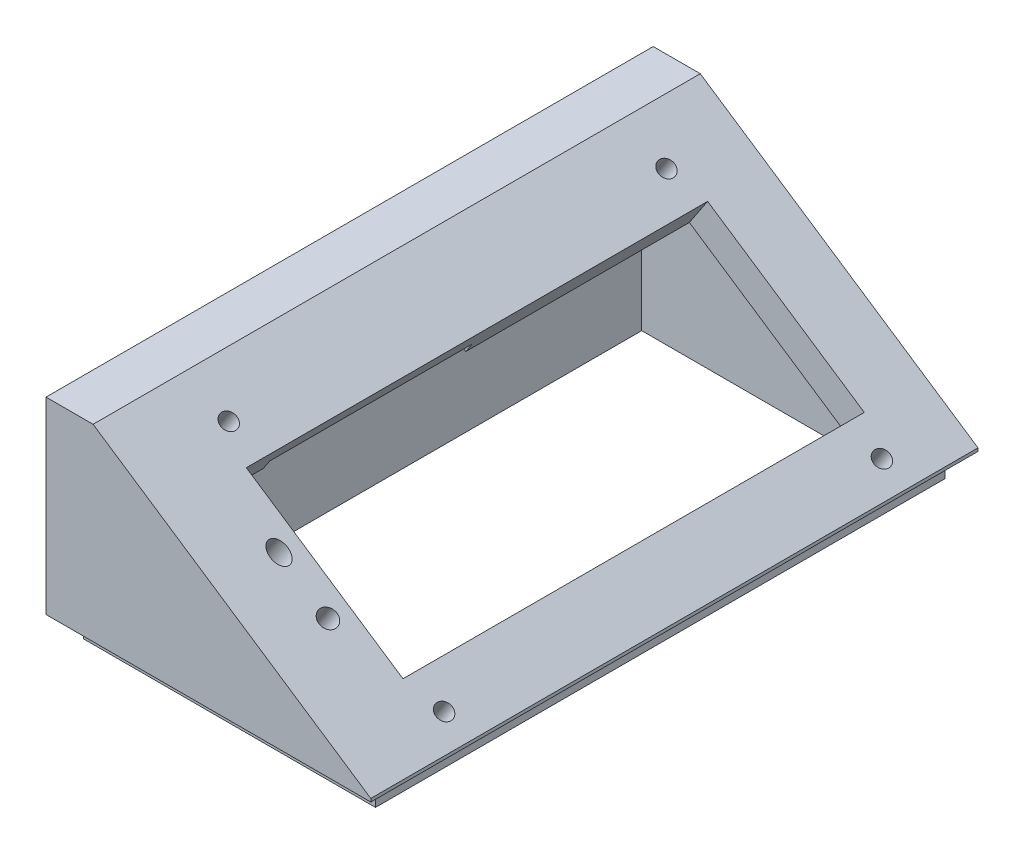
from build123d import *

# Parameters (mm, degrees)
BOSS_EXTRUDE1_DEPTH       = 64.5
SKETCH3_W                 = 62
SKETCH3_H                 = 121
BOSS_EXTRUDE3_DEPTH       = 4.5
SKETCH6_W                 = 40
SKETCH6_H                 = 98
CUT_EXTRUDE3_DEPTH        = 7
SKETCH5_W                 = 57.24
SKETCH5_H                 = 111
CUT_EXTRUDE2_DEPTH        = 1.23
CUT_EXTRUDE1_DEPTH        = 111
CUT_EXTRUDE4_REACH        = 90.677
SKETCH7_R                 = 1.925
SKETCH7_RX                = 2.5
SKETCH7_RY                = 1.85
F_1_0MM_DOWEL_HOLE1_D     = 3.5
F_1_0MM_DOWEL_HOLE1_DEPTH = 7
SKETCH10_W                = 20
SKETCH10_H                = 13
CUT_EXTRUDE5_DEPTH        = 10
SKETCH11_W                = 11
SKETCH11_H                = 43
CUT_EXTRUDE6_DEPTH        = 2.5
SKETCH12_W                = 2
SKETCH12_H                = 8.260777535
CUT_EXTRUDE7_DEPTH        = 153.121661837


with BuildPart() as part:
    # Sketch1 → Boss-Extrude1 (new, symmetric)
    with BuildSketch(Plane.XY):
        Polygon((0, 0), (70, 0), (10, 40), (0, 40), align=None)
    extrude(amount=BOSS_EXTRUDE1_DEPTH, both=True)

    # Sketch3 → Boss-Extrude3 (add)
    with BuildSketch(Plane.XZ):
        with Locations((35, 0)):
            Rectangle(SKETCH3_W, SKETCH3_H)
    extrude(amount=BOSS_EXTRUDE3_DEPTH)

    # Sketch6 → Cut-Extrude3 (cut)
    with BuildSketch(Plane(origin=(21.538461538, 32.307692308, 0), x_dir=(0.8320502943378438, -0.5547001962252291, 0), z_dir=(0.5547001962252291, 0.8320502943378438, 0))):
        with Locations((23.632495094, 2.5)):
            Rectangle(SKETCH6_W, SKETCH6_H)
    extrude(amount=-CUT_EXTRUDE3_DEPTH, mode=Mode.SUBTRACT)

    # Sketch5 → Cut-Extrude2 (cut)
    with BuildSketch(Plane.XZ.offset(4.5)):
        with Locations((35.18, 0)):
            Rectangle(SKETCH5_W, SKETCH5_H)
    extrude(amount=-CUT_EXTRUDE2_DEPTH, mode=Mode.SUBTRACT)

    # Sketch4 → Cut-Extrude1 (cut)
    with BuildSketch(Plane.XY.offset(55.5)):
        Polygon((63.780493494, -4.266615306), (6.558549313, 33.881347482), (6.558549313, -4.5), (63.780493494, -4.5), align=None)
    extrude(amount=-CUT_EXTRUDE1_DEPTH, mode=Mode.SUBTRACT)

    # Sketch7 → Cut-Extrude4 (cut, up to next)
    with BuildSketch(Plane(origin=(21.538461538, 32.307692308, 0), x_dir=(0.8320502943378438, -0.5547001962252291, 0), z_dir=(0.5547001962252291, 0.8320502943378438, 0)), mode=Mode.PRIVATE) as cut_extrude4_sk1:
        with Locations(Location((29.882495094, -51, 0), (0, 0, 180))):
            Circle(SKETCH7_R)
    cut_extrude4_tool1 = extrude(cut_extrude4_sk1.sketch, amount=-CUT_EXTRUDE4_REACH, mode=Mode.PRIVATE) & part.part
    # Sketch7 → Cut-Extrude4 (cut, up to next)
    with BuildSketch(Plane(origin=(21.538461538, 32.307692308, 0), x_dir=(0.8320502943378438, -0.5547001962252291, 0), z_dir=(0.5547001962252291, 0.8320502943378438, 0)), mode=Mode.PRIVATE) as cut_extrude4_sk2:
        with Locations((17.382495094, -51)):
            Ellipse(SKETCH7_RX, SKETCH7_RY)
    cut_extrude4_tool2 = extrude(cut_extrude4_sk2.sketch, amount=-CUT_EXTRUDE4_REACH, mode=Mode.PRIVATE) & part.part
    add(cut_extrude4_tool1.solids().sort_by_distance((46.4022, 15.731866, 51))[0], mode=Mode.SUBTRACT)
    add(cut_extrude4_tool2.solids().sort_by_distance((36.001572, 22.665619, 51))[0], mode=Mode.SUBTRACT)

    # Ø1.0mm Dowel Hole1
    with Locations(Plane(origin=(21.538461538, 32.307692308, 0), x_dir=(0.8320502943378438, -0.5547001962252291, 0), z_dir=(0.5547001962252291, 0.8320502943378438, 0))):
        with Locations((-3.867504906, -44), (-3.867504906, 49), (51.132495094, 49), (51.132495094, -44)):
            Hole(F_1_0MM_DOWEL_HOLE1_D / 2, depth=F_1_0MM_DOWEL_HOLE1_DEPTH)

    # Sketch10 → Cut-Extrude5 (cut)
    with BuildSketch(Plane.ZY):
        with Locations((45.5, 9.5)):
            Rectangle(SKETCH10_W, SKETCH10_H)
    extrude(amount=-CUT_EXTRUDE5_DEPTH, mode=Mode.SUBTRACT)

    # Sketch11 → Cut-Extrude6 (cut)
    with BuildSketch(Plane(origin=(17.655560165, 26.483340247, 0), x_dir=(0.8320502943378436, -0.5547001962252294, 0), z_dir=(-0.5547001962252293, -0.8320502943378435, 0))):
        with Locations((-1.867504906, 17.5)):
            Rectangle(SKETCH11_W, SKETCH11_H)
    extrude(amount=-CUT_EXTRUDE6_DEPTH, mode=Mode.SUBTRACT)

    # Sketch12 → Cut-Extrude7 (cut, through all)
    with BuildSketch(Plane.XY.offset(64.5)):
        with Locations((70, 0.079119359)):
            Rectangle(SKETCH12_W, SKETCH12_H)
    extrude(amount=-CUT_EXTRUDE7_DEPTH, mode=Mode.SUBTRACT)


solid = part.part
